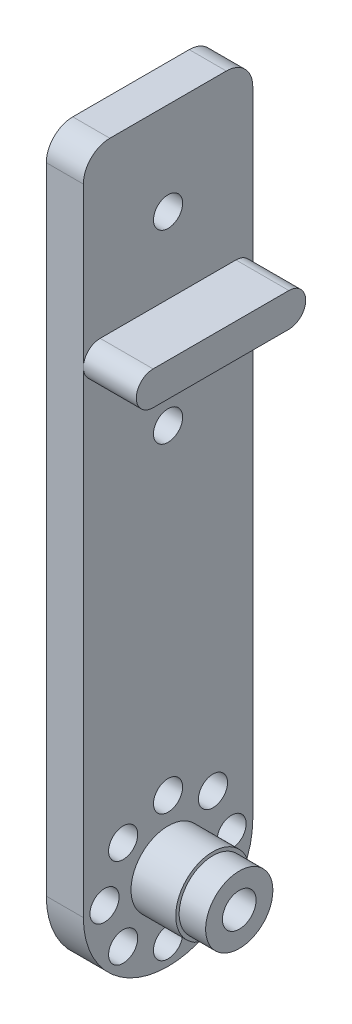
from build123d import *

# Parameters (mm, degrees)
SKETCH1_R           = 2.7499945
SKETCH1_R_2         = 2.75
BOSS_EXTRUDE1_DEPTH = 7
SKETCH3_R           = 7
SKETCH3_R_2         = 3.175
BOSS_EXTRUDE2_DEPTH = 8.449
SKETCH6_R           = 6.35
SKETCH6_R_2         = 3.175
BOSS_EXTRUDE4_DEPTH = 5
BOSS_EXTRUDE5_DEPTH = 10


with BuildPart() as part:
    # Sketch1 → Boss-Extrude1 (new body)
    with BuildSketch(Plane(origin=(0, 0, 0), x_dir=(0, 0, -1), z_dir=(1, 0, 0))):
        with BuildLine():
            Line((-11, 125), (11, 125))
            ThreePointArc((11, 125), (14.535533906, 123.535533906), (16, 120))
            Line((16, 120), (16, 0))
            ThreePointArc((16, 0), (0, -16), (-16, 0))
            Line((-16, 0), (-16, 120))
            ThreePointArc((-16, 120), (-14.535533906, 123.535533906), (-11, 125))
        make_face()
        with Locations((0, 107.5)):
            Circle(SKETCH1_R, mode=Mode.SUBTRACT)
        with Locations((0, 72.5)):
            Circle(SKETCH1_R_2, mode=Mode.SUBTRACT)
        with Locations((0, 12)):
            Circle(SKETCH1_R_2, mode=Mode.SUBTRACT)
        with Locations((8.485281374, 8.485281374)):
            Circle(SKETCH1_R_2, mode=Mode.SUBTRACT)
        with Locations((12, 0)):
            Circle(SKETCH1_R_2, mode=Mode.SUBTRACT)
        with Locations((8.485281374, -8.485281374)):
            Circle(SKETCH1_R_2, mode=Mode.SUBTRACT)
        with Locations((0, -12)):
            Circle(SKETCH1_R_2, mode=Mode.SUBTRACT)
        with Locations((-8.485281374, -8.485281374)):
            Circle(SKETCH1_R_2, mode=Mode.SUBTRACT)
        with Locations((-12, 0)):
            Circle(SKETCH1_R_2, mode=Mode.SUBTRACT)
        with Locations((-8.485281374, 8.485281374)):
            Circle(SKETCH1_R_2, mode=Mode.SUBTRACT)
    extrude(amount=BOSS_EXTRUDE1_DEPTH)

    # Sketch3 → Boss-Extrude2 (add)
    with BuildSketch(Plane(origin=(7, 0, 0), x_dir=(0, 0, -1), z_dir=(1, 0, 0))):
        Circle(SKETCH3_R)
        Circle(SKETCH3_R_2, mode=Mode.SUBTRACT)
    extrude(amount=BOSS_EXTRUDE2_DEPTH)

    # Sketch6 → Boss-Extrude4 (add)
    with BuildSketch(Plane(origin=(15.449, 0, 0), x_dir=(0, 0, -1), z_dir=(1, 0, 0))):
        Circle(SKETCH6_R)
        Circle(SKETCH6_R_2, mode=Mode.SUBTRACT)
    extrude(amount=BOSS_EXTRUDE4_DEPTH)

    # Sketch7 → Boss-Extrude5 (add)
    with BuildSketch(Plane(origin=(7, 0, 0), x_dir=(0, 0, -1), z_dir=(1, 0, 0))):
        with BuildLine():
            Line((-12.825, 93.175), (12.825, 93.175))
            ThreePointArc((12.825, 93.175), (16, 90), (12.825, 86.825))
            Line((12.825, 86.825), (-12.825, 86.825))
            ThreePointArc((-12.825, 86.825), (-16, 90), (-12.825, 93.175))
        make_face()
    extrude(amount=BOSS_EXTRUDE5_DEPTH)


solid = part.part
